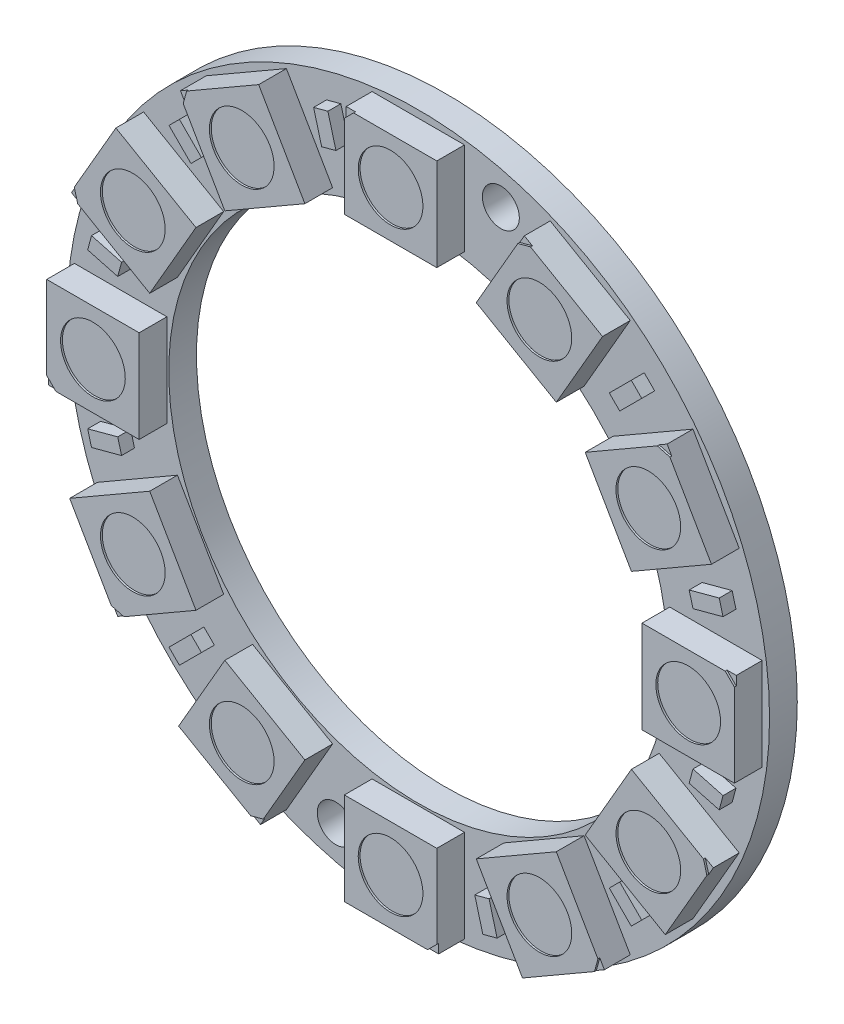
from build123d import *

# Parameters (mm, degrees)
SKETCH_1_R                      = 19
SKETCH_1_R_2                    = 13.5
EXTRUDE_1_DEPTH                 = 1.5
SKETCH_2_W                      = 5
SKETCH_2_H                      = 5
EXTRUDE_2_DEPTH                 = 1.5
PATTERN_CIRCULAR_2_COUNT        = 12
SKETCH_6_R                      = 1.75
CUT_EXTRUDE_1_DEPTH             = 0.1
PATTERN_CIRCULAR_3_COUNT        = 12
SKETCH_7_R                      = 1
CUT_EXTRUDE_2_DEPTH             = 28.037011669
EXTRUDE_3_DEPTH                 = 0.7
PATTERN_CIRCULAR_4_COUNT        = 5
PATTERN_CIRCULAR_4_ANGLE        = 120
PATTERN_CIRCULAR_5_COUNT        = 2
PATTERN_CIRCULAR_5_ANGLE        = 60
PATTERN_CIRCULAR_6_COUNT        = 5
PATTERN_CIRCULAR_6_ANGLE        = 120
PATTERN_CIRCULAR_6_COPY_1_DEPTH = 0.7
PATTERN_CIRCULAR_6_COPY_2_DEPTH = 0.7
PATTERN_CIRCULAR_6_COPY_3_DEPTH = 0.7


with BuildPart() as part:
    # ｽｹｯﾁ1 → ﾎﾞｽ - 押し出し1 (new body)
    with BuildSketch(Plane.XY):
        Circle(SKETCH_1_R)
        Circle(SKETCH_1_R_2, mode=Mode.SUBTRACT)
    extrude(amount=EXTRUDE_1_DEPTH)

    # ｽｹｯﾁ2 → ﾎﾞｽ - 押し出し2 (add)
    with BuildSketch(Plane.XY.offset(1.5)):
        with Locations((0, 16.1)):
            Rectangle(SKETCH_2_W, SKETCH_2_H)
    extrude_2 = extrude(amount=EXTRUDE_2_DEPTH)

    # 円形ﾊﾟﾀｰﾝ2: ﾎﾞｽ - 押し出し2 ×12 about axis
    pattern_circular_2_axis = Axis((0, 0, 0), (0, 0, 1))
    for i in range(1, PATTERN_CIRCULAR_2_COUNT):
        add(extrude_2.rotate(pattern_circular_2_axis, i * 360 / PATTERN_CIRCULAR_2_COUNT))

    # ｽｹｯﾁ6 → ｶｯﾄ - 押し出し1 (cut)
    with BuildSketch(Plane.XY.offset(3)):
        with Locations((0, 16.1)):
            Circle(SKETCH_6_R)
        Polygon((-2.5, 18.1), (-2, 18.6), (-2.5, 18.6), align=None)
    cut_extrude_1 = extrude(amount=-CUT_EXTRUDE_1_DEPTH, mode=Mode.SUBTRACT)

    # 円形ﾊﾟﾀｰﾝ3: ｶｯﾄ - 押し出し1 ×12 about axis
    pattern_circular_3_axis = Axis((0, 0, 0), (0, 0, 1))
    for i in range(1, PATTERN_CIRCULAR_3_COUNT):
        add(cut_extrude_1.rotate(pattern_circular_3_axis, i * 360 / PATTERN_CIRCULAR_3_COUNT), mode=Mode.SUBTRACT)

    # ｽｹｯﾁ7 → ｶｯﾄ - 押し出し2 (cut, through all)
    with BuildSketch(Plane(origin=(0, 0, 0), x_dir=(-1, 0, 0), z_dir=(0, 0, -1))):
        with Locations((4.464628528, -16.662220503)):
            Circle(SKETCH_7_R)
        with Locations((-4.464628528, 16.662220503)):
            Circle(SKETCH_7_R)
    extrude(amount=-CUT_EXTRUDE_2_DEPTH, mode=Mode.SUBTRACT)

    # ｽｹｯﾁ8 → ﾎﾞｽ - 押し出し3 (add)
    with BuildSketch(Plane.XY.offset(1.5)):
        Polygon((4.527475052, -15.351285603), (3.754734391, -15.558340839), (4.190189437, -17.183481193), (4.962930098, -16.976425957), align=None)
    extrude_3 = extrude(amount=EXTRUDE_3_DEPTH)

    # 円形ﾊﾟﾀｰﾝ4: ﾎﾞｽ - 押し出し3 ×5 about axis
    pattern_circular_4_axis = Axis((0, 0, 0), (0, 0, 1))
    for i in range(1, PATTERN_CIRCULAR_4_COUNT):
        add(extrude_3.rotate(pattern_circular_4_axis, i * PATTERN_CIRCULAR_4_ANGLE / (PATTERN_CIRCULAR_4_COUNT - 1)))

    # 円形ﾊﾟﾀｰﾝ5: ﾎﾞｽ - 押し出し3 ×2 about axis
    pattern_circular_5_axis = Axis((0, 0, 0), (0, 0, -1))
    for i in range(1, PATTERN_CIRCULAR_5_COUNT):
        add(extrude_3.rotate(pattern_circular_5_axis, i * PATTERN_CIRCULAR_5_ANGLE / (PATTERN_CIRCULAR_5_COUNT - 1)))

    # 円形ﾊﾟﾀｰﾝ6: ﾎﾞｽ - 押し出し3 ×5 about axis, 1 skipped
    pattern_circular_6_axis = Axis((0, 0, 1.5), (0, 0, -1))
    add([extrude_3.rotate(pattern_circular_6_axis, i * PATTERN_CIRCULAR_6_ANGLE / (PATTERN_CIRCULAR_6_COUNT - 1)) for i in range(1, PATTERN_CIRCULAR_6_COUNT) if i not in (1,)])

    # 円形ﾊﾟﾀｰﾝ6 copy 1 sketch → 円形ﾊﾟﾀｰﾝ6 copy 1 (add)
    with BuildSketch(Plane(origin=(0, 0, 1.5), x_dir=(-0.5000000000000044, -0.866025403784436, 0), z_dir=(0, 0, 1))):
        Polygon((4.527475052, -15.351285603), (3.754734391, -15.558340839), (4.190189437, -17.183481193), (4.962930098, -16.976425957), align=None)
    extrude(amount=PATTERN_CIRCULAR_6_COPY_1_DEPTH)

    # 円形ﾊﾟﾀｰﾝ6 copy 2 sketch → 円形ﾊﾟﾀｰﾝ6 copy 2 (add)
    with BuildSketch(Plane(origin=(0, 0, 1.5), x_dir=(-0.8660254037844418, -0.49999999999999456, 0), z_dir=(0, 0, 1))):
        Polygon((4.527475052, -15.351285603), (3.754734391, -15.558340839), (4.190189437, -17.183481193), (4.962930098, -16.976425957), align=None)
    extrude(amount=PATTERN_CIRCULAR_6_COPY_2_DEPTH)

    # 円形ﾊﾟﾀｰﾝ6 copy 3 sketch → 円形ﾊﾟﾀｰﾝ6 copy 3 (add)
    with BuildSketch(Plane(origin=(0, 0, 1.5), x_dir=(-1, 0, 0), z_dir=(0, 0, 1))):
        Polygon((4.527475052, -15.351285603), (3.754734391, -15.558340839), (4.190189437, -17.183481193), (4.962930098, -16.976425957), align=None)
    extrude(amount=PATTERN_CIRCULAR_6_COPY_3_DEPTH)


solid = part.part
